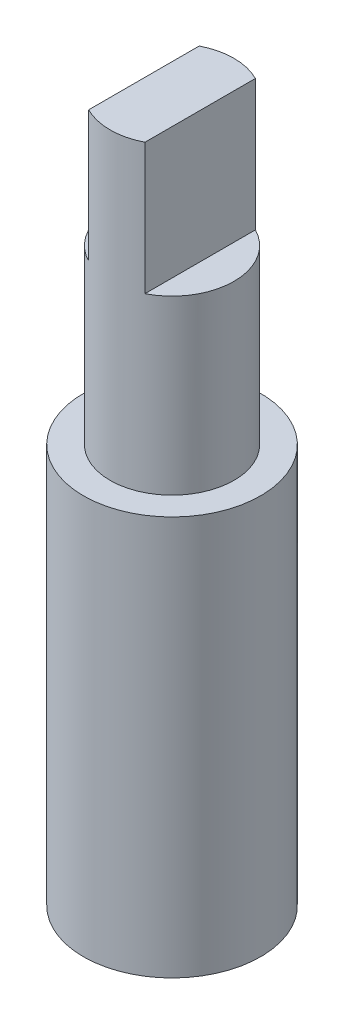
from build123d import *

# Parameters (mm, degrees)
SKETCH1_R           = 3.075
BOSS_EXTRUDE1_DEPTH = 13.85
SKETCH2_R           = 2.15
BOSS_EXTRUDE2_DEPTH = 5.98
BOSS_EXTRUDE3_DEPTH = 4.55
SKETCH4_R           = 2.15
CUT_EXTRUDE1_DEPTH  = 1.95


with BuildPart() as part:
    # Sketch1 → Boss-Extrude1 (new body)
    with BuildSketch(Plane(origin=(0, 0, 0), x_dir=(1, 0, 0), z_dir=(0, 1, 0))):
        with Locations(Location((0, 0, 0), (0, 0, 270))):
            Circle(SKETCH1_R)
    extrude(amount=BOSS_EXTRUDE1_DEPTH)

    # Sketch2 → Boss-Extrude2 (add)
    with BuildSketch(Plane(origin=(0, 13.85, 0), x_dir=(1, 0, 0), z_dir=(0, 1, 0))):
        with Locations(Location((0, 0, 0), (0, 0, 90))):
            Circle(SKETCH2_R)
    extrude(amount=BOSS_EXTRUDE2_DEPTH)

    # Sketch3 → Boss-Extrude3 (add)
    with BuildSketch(Plane(origin=(0, 19.83, 0), x_dir=(1, 0, 0), z_dir=(0, 1, 0))):
        with BuildLine():
            Line((-0.975, 1.916213715), (-0.975, -1.916213715))
            ThreePointArc((-0.975, -1.916213715), (0, -2.15), (0.975, -1.916213715))
            Line((0.975, -1.916213715), (0.975, 1.916213715))
            ThreePointArc((0.975, 1.916213715), (0, 2.15), (-0.975, 1.916213715))
        make_face()
    extrude(amount=BOSS_EXTRUDE3_DEPTH)

    # Sketch4 → Cut-Extrude1 (cut)
    with BuildSketch(Plane.XZ):
        with Locations(Location((0, 0, 0), (0, 0, 243.032284463))):
            Circle(SKETCH4_R)
    extrude(amount=-CUT_EXTRUDE1_DEPTH, mode=Mode.SUBTRACT)


solid = part.part
